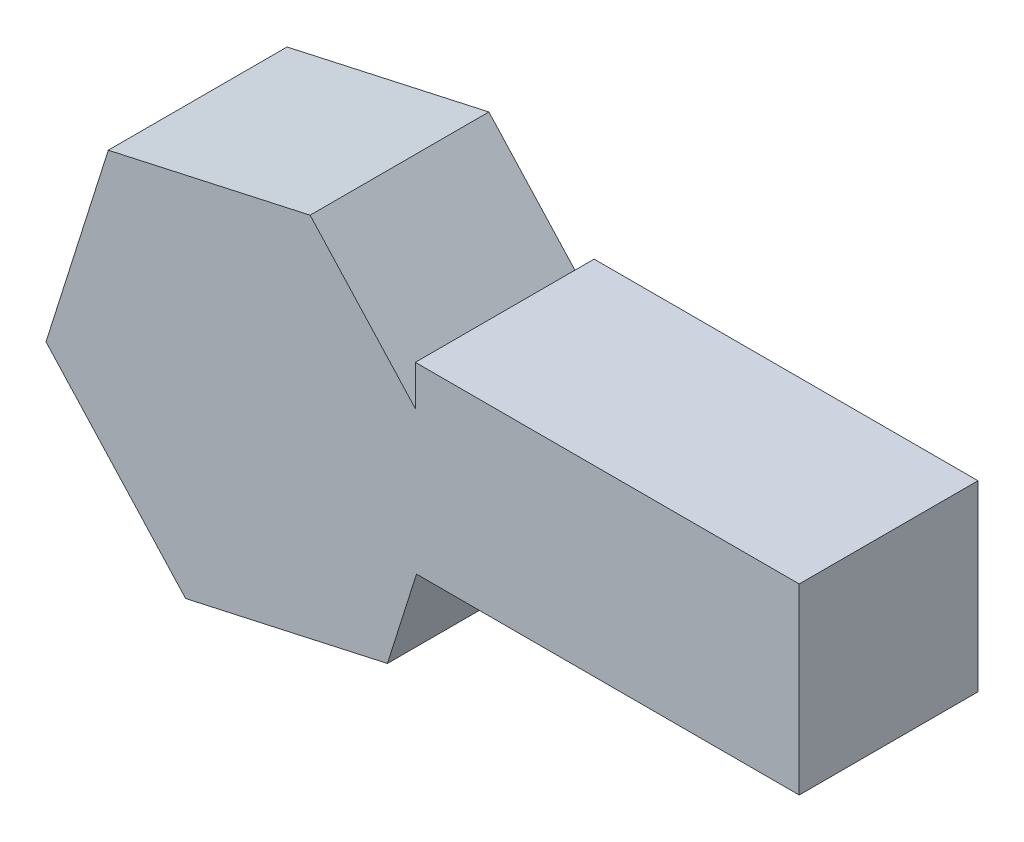
from build123d import *

# Parameters (mm, degrees)
BOSS_EXTRUDE1_DEPTH = 123.952


with BuildPart() as part:
    # Sketch1 → Boss-Extrude1 (new body)
    with BuildSketch(Plane.XY):
        with BuildLine():
            ThreePointArc((-150.141788754, -129.869756414), (-205.816359245, -15.653721009), (-181.433254288, 109.047621148))
            Line((-181.433254288, 109.047621148), (-187.831275189, 116.037713042))
            Line((-187.831275189, 116.037713042), (-327.77572694, 85.095221198))
            Line((-327.77572694, 85.095221198), (-370.950968822, -51.57147506))
            Line((-370.950968822, -51.57147506), (-274.181758953, -157.295679473))
            Line((-274.181758953, -157.295679473), (-150.141788754, -129.869756414))
        make_face()
        Polygon((151.2671863, 64.164969875), (-114.883967634, 64.164969875), (-114.883967634, 36.339882858), (-91.062065319, 10.313508629), (-114.09129189, -62.583090802), (151.2671863, -62.583090802), align=None)
        Polygon((-91.062065319, 10.313508629), (-114.883967634, 36.339882858), (-114.883967634, -62.583090802), (-114.09129189, -62.583090802), align=None)
        with BuildLine():
            Line((-114.883967634, -62.583090802), (-114.883967634, 36.339882858))
            Line((-114.883967634, 36.339882858), (-181.433254288, 109.047621148))
            ThreePointArc((-181.433254288, 109.047621148), (-205.816359245, -15.653721009), (-150.141788754, -129.869756414))
            Line((-150.141788754, -129.869756414), (-134.237307201, -126.353187629))
            Line((-134.237307201, -126.353187629), (-114.09129189, -62.583090802))
            Line((-114.09129189, -62.583090802), (-114.883967634, -62.583090802))
        make_face()
    extrude(amount=BOSS_EXTRUDE1_DEPTH)


solid = part.part
